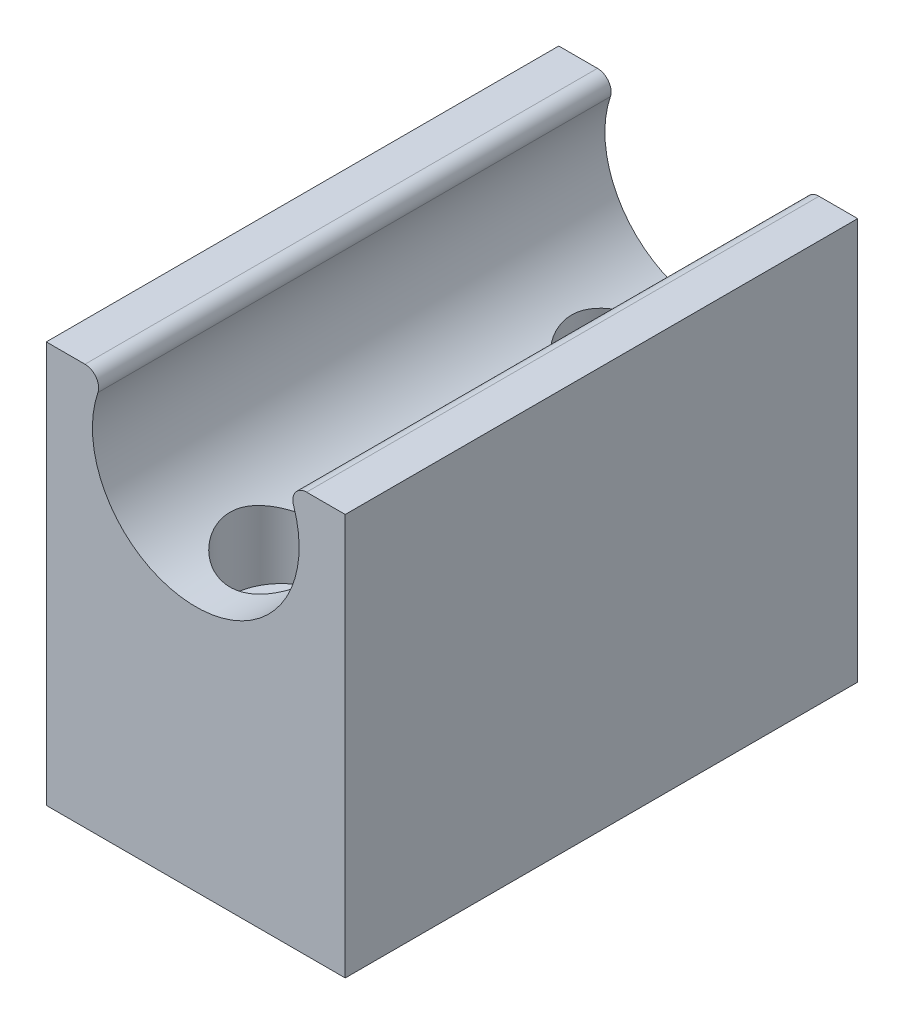
from build123d import *

# Parameters (mm, degrees)
BOSS_EXTRUDE1_DEPTH = 30
FILLET1_R           = 0.8
SKETCH3_R           = 3
CUT_EXTRUDE1_DEPTH  = 12.5
SKETCH4_R           = 1.55
CUT_EXTRUDE2_DEPTH  = 40.100032046


with BuildPart() as part:
    # Sketch1 → Boss-Extrude1 (new body)
    with BuildSketch(Plane.XY):
        with BuildLine():
            Line((-5.25, 11.75), (-8.75, 11.75))
            Line((-8.75, 11.75), (-8.75, -11.75))
            Line((-8.75, -11.75), (8.75, -11.75))
            Line((8.75, -11.75), (8.75, 11.75))
            Line((8.75, 11.75), (5.25, 11.75))
            ThreePointArc((5.25, 11.75), (0, 2.693340724), (-5.25, 11.75))
        make_face()
    extrude(amount=BOSS_EXTRUDE1_DEPTH)

    # Fillet1
    fillet1_edges = [part.edges().sort_by_distance(p)[0] for p in [
        (-5.25, 11.75, 15),
        (5.25, 11.75, 15),
    ]]
    fillet(fillet1_edges, radius=FILLET1_R)

    # Sketch3 → Cut-Extrude1 (cut)
    with BuildSketch(Plane(origin=(0, 11.75, 0), x_dir=(1, 0, 0), z_dir=(0, 1, 0))):
        with Locations(Location((0, -5, 0), (0, 0, 180))):
            Circle(SKETCH3_R)
        with Locations(Location((0, -25, 0), (0, 0, 180))):
            Circle(SKETCH3_R)
    extrude(amount=-CUT_EXTRUDE1_DEPTH, mode=Mode.SUBTRACT)

    # Sketch4 → Cut-Extrude2 (cut, through all)
    with BuildSketch(Plane(origin=(0, 11.75, 0), x_dir=(1, 0, 0), z_dir=(0, 1, 0))):
        with Locations(Location((0, -5, 0), (0, 0, 180))):
            Circle(SKETCH4_R)
        with Locations(Location((0, -25, 0), (0, 0, 180))):
            Circle(SKETCH4_R)
    extrude(amount=-CUT_EXTRUDE2_DEPTH, mode=Mode.SUBTRACT)


solid = part.part
